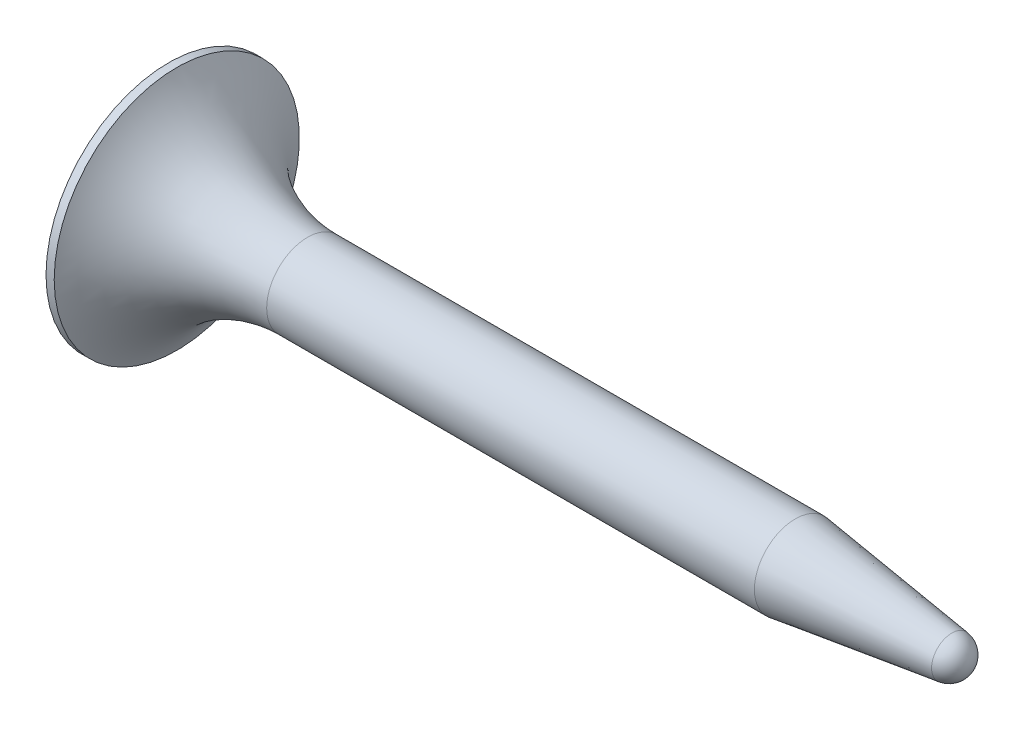
from build123d import *


with BuildPart() as part:
    # Sketch1 → Revolve1 (revolve)
    with BuildSketch(Plane.XY, mode=Mode.PRIVATE) as revolve1_sk:
        with BuildLine():
            Line((0, -3.81), (0, 0))
            Line((0, 0), (24.892, 0))
            ThreePointArc((24.892, 0), (24.734418278, -0.418684593), (24.339884132, -0.629567487))
            Line((24.339884132, -0.629567487), (19.475316237, -1.27))
            Line((19.475316237, -1.27), (4.318, -1.27))
            ThreePointArc((4.318, -1.27), (1.921768792, -1.957230068), (0.254, -3.81))
            Line((0.254, -3.81), (0, -3.81))
        make_face()
    revolve(revolve1_sk.sketch.rotate(Axis((0, 0, 0), (1, 0, 0)), 270), axis=Axis((0, 0, 0), (1, 0, 0)))


solid = part.part
